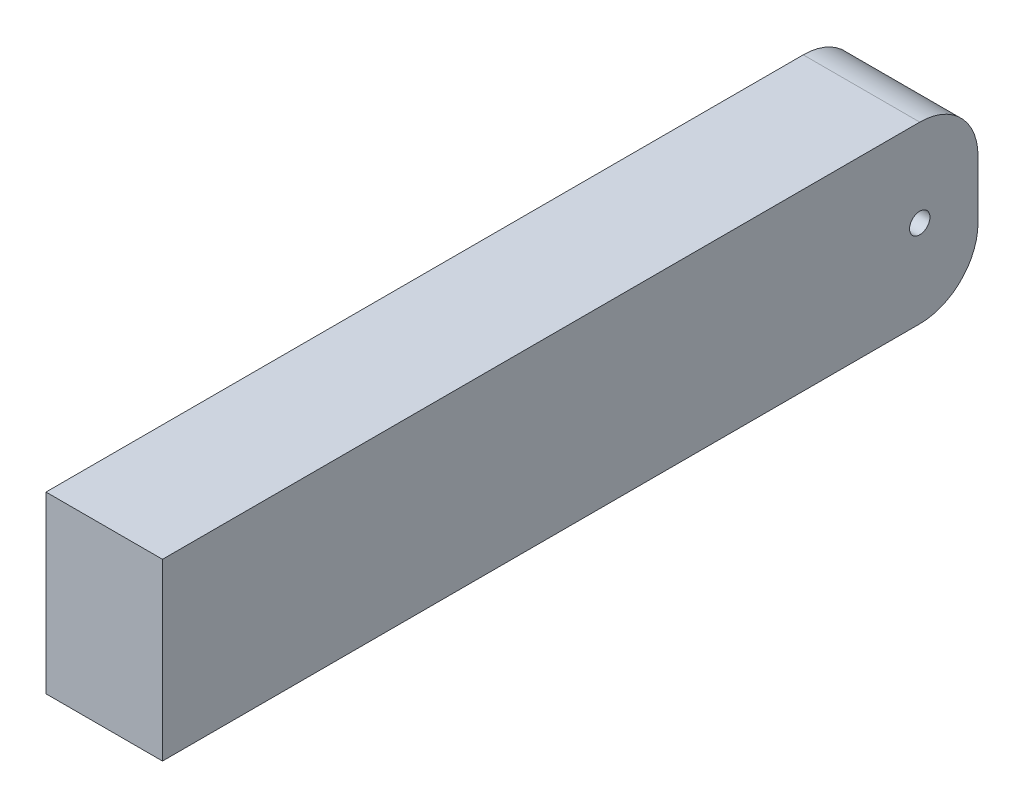
from build123d import *

# Parameters (mm, degrees)
SKETCH1_W           = 20
SKETCH1_H           = 30
BOSS_EXTRUDE1_DEPTH = 140
FILLET1_R           = 10
SKETCH2_R           = 1.75
CUT_EXTRUDE1_DEPTH  = 143.214626533
SKETCH3_R           = 4.75
CUT_EXTRUDE2_DEPTH  = 15


with BuildPart() as part:
    # Sketch1 → Boss-Extrude1 (new body)
    with BuildSketch(Plane.XY):
        Rectangle(SKETCH1_W, SKETCH1_H)
    extrude(amount=BOSS_EXTRUDE1_DEPTH)

    # Fillet1
    fillet1_edges = [part.edges().sort_by_distance(p)[0] for p in [
        (0, -15, 0),
        (0, 15, 0),
    ]]
    fillet(fillet1_edges, radius=FILLET1_R)

    # Sketch2 → Cut-Extrude1 (cut, through all)
    with BuildSketch(Plane(origin=(10, 0, 0), x_dir=(0, 0, -1), z_dir=(1, 0, 0))):
        with Locations(Location((-10, 0, 0), (0, 0, 90))):
            Circle(SKETCH2_R)
    extrude(amount=-CUT_EXTRUDE1_DEPTH, mode=Mode.SUBTRACT)

    # Sketch3 → Cut-Extrude2 (cut)
    with BuildSketch(Plane.ZY.offset(10)):
        with Locations(Location((10, 0, 0), (0, 0, 270))):
            Circle(SKETCH3_R)
    extrude(amount=-CUT_EXTRUDE2_DEPTH, mode=Mode.SUBTRACT)


solid = part.part
